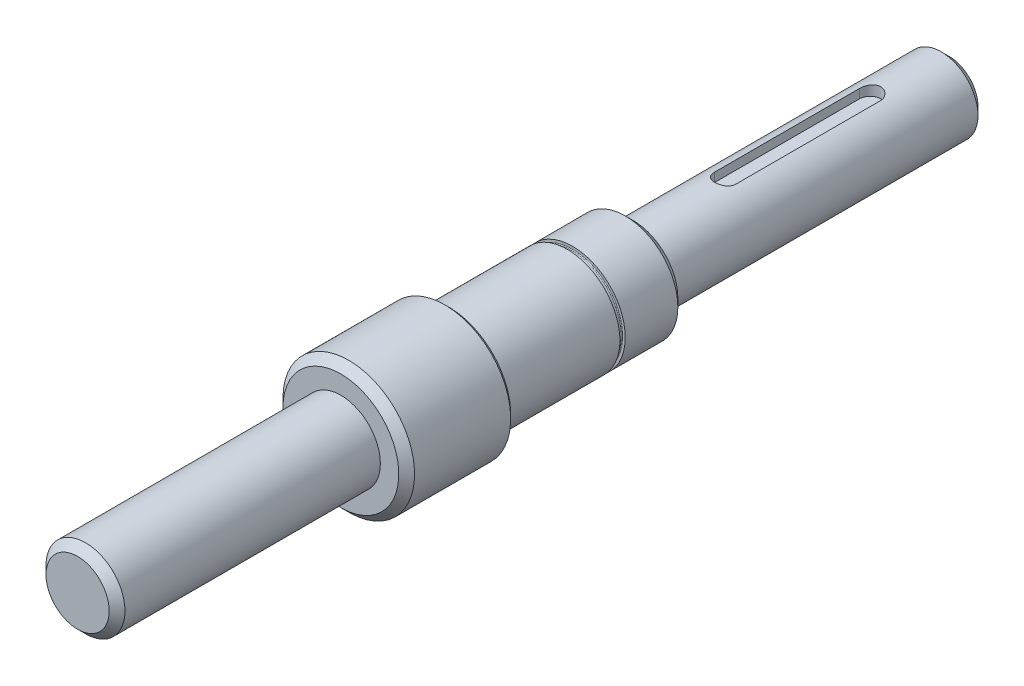
from build123d import *

# Parameters (mm, degrees)
CHAMFER_1_SIZE         = 3
HOLE_WIZARD_M121_D     = 10.2
HOLE_WIZARD_M121_DEPTH = 30
HOLE_WIZARD_M121_TIP   = 3.064389157
SKETCH_4_R             = 20
SKETCH_4_R_2           = 18.75
CUT_EXTRUDE_1_DEPTH    = 2
FILLET_1_R             = 0.3
CHAMFER_2_SIZE         = 1.5
CUT_EXTRUDE_2_DEPTH    = 334.782863551
SKETCH_9_R             = 25
SKETCH_9_R_2           = 20
CUT_EXTRUDE_4_DEPTH    = 6
CHAMFER_3_SIZE         = 1.5
CHAMFER_4_SIZE         = 3


with BuildPart() as part:
    # Эскиз1 → Повернуть1 (revolve)
    with BuildSketch(Plane(origin=(0, 0, 0), x_dir=(0, 0, -1), z_dir=(1, 0, 0))):
        Polygon((0, 0), (0, 15), (100, 15), (100, 25), (147, 25), (147, 20), (211, 20), (211, 14), (331, 14), (331, 0), align=None)
    revolve(axis=Axis((0, 0, 0), (0, 0, -1)))

    # Фаска1
    chamfer_1_edges = [part.edges().sort_by_distance(p)[0] for p in [
        (0, -25, -100),
        (0, -15, 0),
        (0, -14, -331),
    ]]
    chamfer(chamfer_1_edges, length=CHAMFER_1_SIZE)

    # Отверстие обработанное метчиком M121
    with Locations(Plane(origin=(0, 0, -331), x_dir=(-1, 0, 0), z_dir=(0, 0, -1))):
        with Locations((0, 0)):
            Hole(HOLE_WIZARD_M121_D / 2, depth=HOLE_WIZARD_M121_DEPTH)
            with Locations((0, 0, -(HOLE_WIZARD_M121_DEPTH + HOLE_WIZARD_M121_TIP / 2))):  # 118° drill point
                Cone(0, HOLE_WIZARD_M121_D / 2, HOLE_WIZARD_M121_TIP, mode=Mode.SUBTRACT)

    # Эскиз4 → Вырез-Вытянуть1 (cut)
    with BuildSketch(Plane(origin=(0, 0, -188), x_dir=(-1, 0, 0), z_dir=(0, 0, -1))):
        Circle(SKETCH_4_R)
        Circle(SKETCH_4_R_2, mode=Mode.SUBTRACT)
    extrude(amount=-CUT_EXTRUDE_1_DEPTH, mode=Mode.SUBTRACT)

    # Скругление1
    fillet_1_edges = [part.edges().sort_by_distance(p)[0] for p in [
        (18.75, 0, -186),
        (18.75, 0, -188),
    ]]
    fillet(fillet_1_edges, radius=FILLET_1_R)

    # Фаска2
    chamfer_2_edges = [part.edges().sort_by_distance(p)[0] for p in [
        (0, -25, -147),
    ]]
    chamfer(chamfer_2_edges, length=CHAMFER_2_SIZE)

    # Эскиз8 → Вырез-Вытянуть2 (cut, through all)
    with BuildSketch(Plane(origin=(0, 10, -331), x_dir=(-1, 0, 0), z_dir=(0, -1, 0))):
        with BuildLine():
            Line((4, -30), (4, -85))
            ThreePointArc((4, -85), (0, -89), (-4, -85))
            Line((-4, -85), (-4, -30))
            ThreePointArc((-4, -30), (0, -26), (4, -30))
        make_face()
    extrude(amount=-CUT_EXTRUDE_2_DEPTH, mode=Mode.SUBTRACT)

    # Эскиз9 → Вырез-Вытянуть4 (cut)
    with BuildSketch(Plane(origin=(0, 0, -147), x_dir=(-1, 0, 0), z_dir=(0, 0, -1))):
        Circle(SKETCH_9_R)
        Circle(SKETCH_9_R_2, mode=Mode.SUBTRACT)
    extrude(amount=-CUT_EXTRUDE_4_DEPTH, mode=Mode.SUBTRACT)

    # Фаска3
    chamfer_3_edges = [part.edges().sort_by_distance(p)[0] for p in [
        (0, -25, -141),
    ]]
    chamfer(chamfer_3_edges, length=CHAMFER_3_SIZE)

    # Фаска4
    chamfer_4_edges = [part.edges().sort_by_distance(p)[0] for p in [
        (0, -20, -211),
    ]]
    chamfer(chamfer_4_edges, length=CHAMFER_4_SIZE)


solid = part.part
